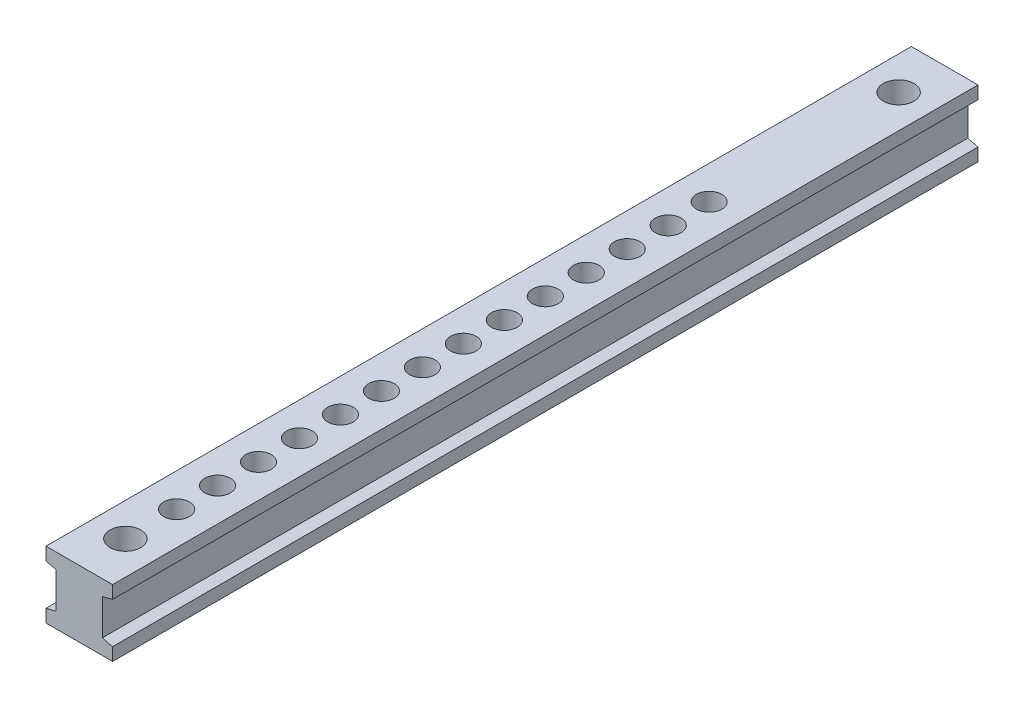
from build123d import *

# Parameters (mm, degrees)
BOSS_EXTRUDE1_DEPTH     = 84.5
CUT_EXTRUDE1_DEPTH      = 85.998529399
CUT_EXTRUDE1_DEPTH_BACK = 85.998529399
SKETCH2_R               = 3
SKETCH2_R_2             = 2.5


with BuildPart() as part:
    # Sketch1 → Boss-Extrude1 (new, symmetric)
    with BuildSketch(Plane.XY):
        Polygon((4.5, 3.5), (6.5, 4), (6.5, 6.5), (-6.5, 6.5), (-6.5, 4), (-4.5, 3.5), (-4.5, -3.5), (-6.5, -4), (-6.5, -6.5), (6.5, -6.5), (6.5, -4), (4.5, -3.5), align=None)
    extrude(amount=BOSS_EXTRUDE1_DEPTH, both=True)

    # Sketch2 → Cut-Extrude1 (cut, two sides: drawn at the far end of the back side and taken through both)
    with BuildSketch(Plane(origin=(0, 0, 0), x_dir=(1, 0, 0), z_dir=(0, 1, 0)).offset(-CUT_EXTRUDE1_DEPTH_BACK)):
        with Locations(Location((0, 75.5, 0), (0, 0, 270))):
            Circle(SKETCH2_R)
        with Locations(Location((0, -75.5, 0), (0, 0, 270))):
            Circle(SKETCH2_R)
        with Locations(Location((0, -65.5, 0), (0, 0, 270))):
            Circle(SKETCH2_R_2)
        with Locations(Location((0, -57.5, 0), (0, 0, 270))):
            Circle(SKETCH2_R_2)
        with Locations(Location((0, -49.5, 0), (0, 0, 270))):
            Circle(SKETCH2_R_2)
        with Locations(Location((0, -41.5, 0), (0, 0, 270))):
            Circle(SKETCH2_R_2)
        with Locations(Location((0, -33.5, 0), (0, 0, 270))):
            Circle(SKETCH2_R_2)
        with Locations(Location((0, -25.5, 0), (0, 0, 270))):
            Circle(SKETCH2_R_2)
        with Locations(Location((0, -17.5, 0), (0, 0, 270))):
            Circle(SKETCH2_R_2)
        with Locations(Location((0, -9.5, 0), (0, 0, 270))):
            Circle(SKETCH2_R_2)
        with Locations(Location((0, -1.5, 0), (0, 0, 270))):
            Circle(SKETCH2_R_2)
        with Locations(Location((0, 6.5, 0), (0, 0, 270))):
            Circle(SKETCH2_R_2)
        with Locations(Location((0, 14.5, 0), (0, 0, 270))):
            Circle(SKETCH2_R_2)
        with Locations(Location((0, 22.5, 0), (0, 0, 270))):
            Circle(SKETCH2_R_2)
        with Locations(Location((0, 30.5, 0), (0, 0, 270))):
            Circle(SKETCH2_R_2)
        with Locations(Location((0, 38.5, 0), (0, 0, 270))):
            Circle(SKETCH2_R_2)
    extrude(amount=CUT_EXTRUDE1_DEPTH + CUT_EXTRUDE1_DEPTH_BACK, mode=Mode.SUBTRACT)


solid = part.part
